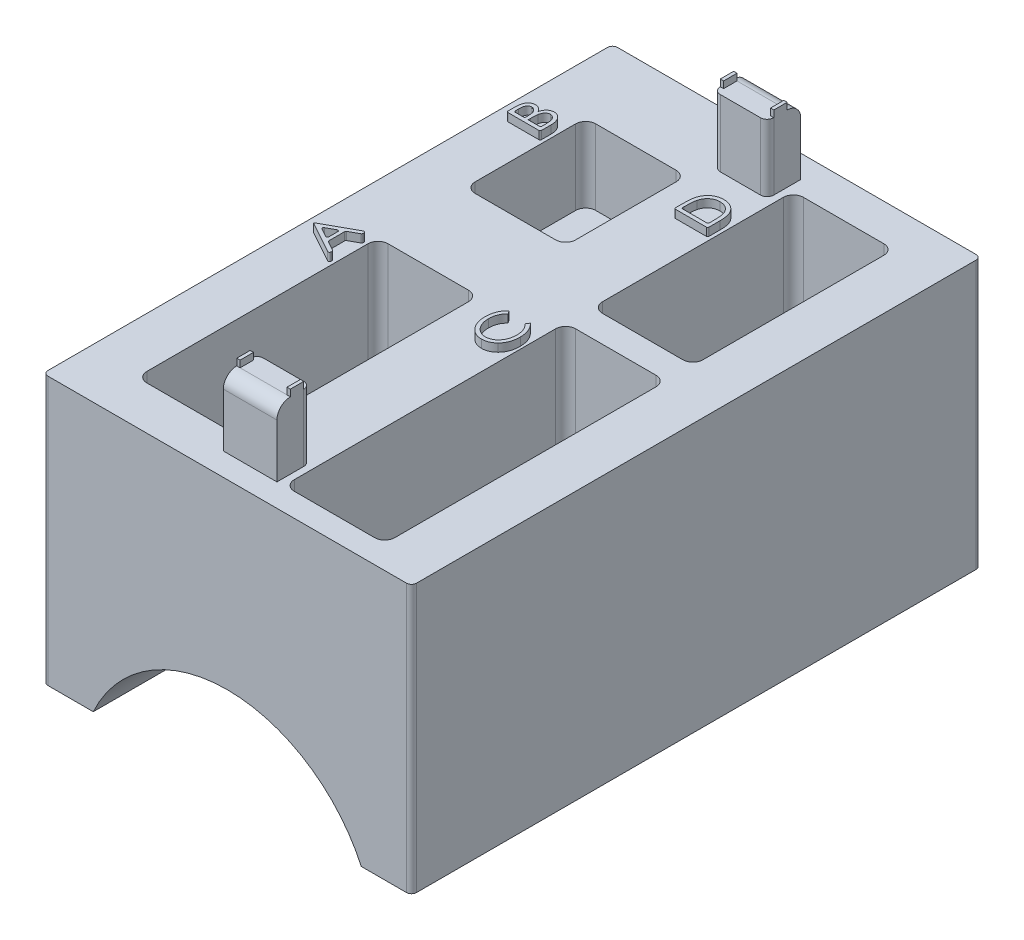
from build123d import *

# Parameters (mm, degrees)
BOSS_EXTRUDE1_DEPTH = 42.5
SKETCH2_W           = 15
SKETCH2_H           = 36
CUT_EXTRUDE1_DEPTH  = 20.4
SKETCH2_4_W         = 15
SKETCH2_4_H         = 18
CUT_EXTRUDE2_DEPTH  = 11.2
SKETCH2_5_W         = 15
SKETCH2_5_H         = 42
CUT_EXTRUDE3_DEPTH  = 24.222
SKETCH2_6_W         = 15
SKETCH2_6_H         = 30
CUT_EXTRUDE4_DEPTH  = 19.6
FILLET1_R           = 1.5
FILLET2_R           = 0.75
BOSS_EXTRUDE2_DEPTH = 1.2
FILLET4_R           = 0.2
BOSS_EXTRUDE3_DEPTH = 10
FILLET5_R           = 2
FILLET6_R           = 1
SKETCH7_W           = 0.5
SKETCH7_H           = 2
BOSS_EXTRUDE4_DEPTH = 1


with BuildPart() as part:
    # Sketch1 → Boss-Extrude1 (new, symmetric)
    with BuildSketch(Plane.XY):
        with BuildLine():
            Line((-20, 0), (-27.5, 0))
            Line((-27.5, 0), (-27.5, 40))
            Line((-27.5, 40), (27.5, 40))
            Line((27.5, 40), (27.5, 0))
            Line((27.5, 0), (20, 0))
            ThreePointArc((20, 0), (0, 12.850442522), (-20, 0))
        make_face()
    extrude(amount=BOSS_EXTRUDE1_DEPTH, both=True)

    # Sketch2 → Cut-Extrude1 (cut)
    with BuildSketch(Plane(origin=(0, 40, 0), x_dir=(1, 0, 0), z_dir=(0, 1, 0))):
        with Locations((-12.5, -18)):
            Rectangle(SKETCH2_W, SKETCH2_H)
    extrude(amount=-CUT_EXTRUDE1_DEPTH, mode=Mode.SUBTRACT)

    # Sketch2<4> → Cut-Extrude2 (cut)
    with BuildSketch(Plane(origin=(0, 40, 0), x_dir=(1, 0, 0), z_dir=(0, 1, 0))):
        with Locations((-12.5, 22)):
            Rectangle(SKETCH2_4_W, SKETCH2_4_H)
    extrude(amount=-CUT_EXTRUDE2_DEPTH, mode=Mode.SUBTRACT)

    # Sketch2<5> → Cut-Extrude3 (cut)
    with BuildSketch(Plane(origin=(0, 40, 0), x_dir=(1, 0, 0), z_dir=(0, 1, 0))):
        with Locations((12.5, -18)):
            Rectangle(SKETCH2_5_W, SKETCH2_5_H)
    extrude(amount=-CUT_EXTRUDE3_DEPTH, mode=Mode.SUBTRACT)

    # Sketch2<6> → Cut-Extrude4 (cut)
    with BuildSketch(Plane(origin=(0, 40, 0), x_dir=(1, 0, 0), z_dir=(0, 1, 0))):
        with Locations((12.5, 22)):
            Rectangle(SKETCH2_6_W, SKETCH2_6_H)
    extrude(amount=-CUT_EXTRUDE4_DEPTH, mode=Mode.SUBTRACT)

    # Fillet1
    fillet1_edges = [part.edges().sort_by_distance(p)[0] for p in [
        (20, 27.889, 39),
        (20, 27.889, -3),
        (5, 27.889, 39),
        (5, 27.889, -3),
        (20, 30.2, -7),
        (20, 30.2, -37),
        (5, 30.2, -7),
        (5, 30.2, -37),
        (-5, 34.4, -31),
        (-20, 34.4, -31),
        (-5, 34.4, -13),
        (-20, 34.4, -13),
        (-5, 29.8, 36),
        (-20, 29.8, 36),
        (-5, 29.8, 0),
        (-20, 29.8, 0),
    ]]
    fillet(fillet1_edges, radius=FILLET1_R)

    # Fillet2
    fillet2_edges = [part.edges().sort_by_distance(p)[0] for p in [
        (-27.5, 20, -42.5),
        (27.5, 20, -42.5),
        (-27.5, 20, 42.5),
        (27.5, 20, 42.5),
    ]]
    fillet(fillet2_edges, radius=FILLET2_R)

    # Sketch5 → Boss-Extrude2 (add)
    # profile 1 of 4: a face of its own
    with BuildSketch(Plane(origin=(0, 40, 0), x_dir=(1, 0, 0), z_dir=(0, 1, 0))):
        Polygon((-25.5, -4.115384615), (-20.5, -6.871794872), (-20.5, -6.235777244), (-22.102564103, -5.352363782), (-22.102564103, -2.751201923), (-20.5, -1.866786859), (-20.5, -1.230769231), (-25.5, -3.987179487), align=None)
        Polygon((-24.461338141, -4.051282051), (-22.615384615, -3.032652244), (-22.615384615, -5.068910256), align=None, mode=Mode.SUBTRACT)
    # profile 2 of 4: a face of its own
    with BuildSketch(Plane(origin=(0, 40, 0), x_dir=(1, 0, 0), z_dir=(0, 1, 0))):
        with BuildLine():
            Line((-25.5, 24.705128205), (-25.5, 25.876001603))
            add(Edge.make_bspline(
                [(-25.5, 25.876001603), (-25.499742433, 25.933103166), (-25.499240644, 26.044347721), (-25.491718192, 26.205976254), (-25.481597085, 26.357417989), (-25.464581303, 26.498199584), (-25.447103367, 26.629267155), (-25.421387349, 26.74974346), (-25.392719866, 26.86018845), (-25.349420335, 26.992410975), (-25.282058739, 27.142330247), (-25.18083749, 27.303727704), (-25.061157274, 27.445633304), (-24.922292074, 27.564683477), (-24.770646634, 27.661094775), (-24.608314865, 27.731508422), (-24.437110864, 27.773870443), (-24.320010934, 27.779310605), (-24.261017628, 27.782051282)],
                knots=[0, 0, 0, 0, 1.070853485, 2.086223449, 3.034271819, 3.916640579, 4.745529013, 5.513087507, 6.225428865, 6.884831129, 8.120833458, 9.29701588, 10.447582825, 11.588636263, 12.71438098, 13.805475256, 14.89442916, 16, 16, 16, 16], degree=3))
            add(Edge.make_bspline(
                [(-24.261017628, 27.782051282), (-24.205720411, 27.780200051), (-24.096634851, 27.776548102), (-23.93783809, 27.739448418), (-23.786226163, 27.682303211), (-23.643756772, 27.600210112), (-23.510966162, 27.496658706), (-23.390736803, 27.37101206), (-23.284556302, 27.222909914), (-23.227024425, 27.112766211), (-23.197315705, 27.055889423)],
                knots=[0, 0, 0, 0, 0.972469563, 1.918403701, 2.856555263, 3.817919515, 4.802528741, 5.813205558, 6.870767551, 8, 8, 8, 8], degree=3))
            add(Edge.make_bspline(
                [(-23.197315705, 27.055889423), (-23.175528868, 27.124976233), (-23.134010452, 27.256632564), (-23.060781467, 27.439035026), (-22.98019595, 27.595676288), (-22.8948897, 27.730013051), (-22.79880937, 27.842918214), (-22.696995011, 27.943375401), (-22.583819936, 28.028305778), (-22.463239999, 28.100984375), (-22.335447731, 28.159439189), (-22.201008989, 28.200230211), (-22.061863716, 28.226590056), (-21.967133457, 28.229366452), (-21.919270833, 28.230769231)],
                knots=[0, 0, 0, 0, 1.388621881, 2.646248426, 3.762785984, 4.762390772, 5.689342799, 6.59922982, 7.499246159, 8.395041384, 9.294579566, 10.185467042, 11.083204162, 12, 12, 12, 12], degree=3))
            add(Edge.make_bspline(
                [(-21.919270833, 28.230769231), (-21.870433022, 28.229252528), (-21.77415246, 28.226262447), (-21.632681278, 28.201818451), (-21.497854554, 28.160094593), (-21.367995741, 28.103803482), (-21.244605642, 28.029898943), (-21.126375989, 27.940192743), (-21.015612042, 27.83276415), (-20.90950492, 27.712201791), (-20.812528546, 27.57793568), (-20.729489519, 27.430297992), (-20.658235192, 27.272839854), (-20.59967908, 27.103949269), (-20.555152426, 26.923829022), (-20.523698385, 26.732570811), (-20.502662562, 26.530850823), (-20.500901825, 26.392550369), (-20.5, 26.321714744)],
                knots=[0, 0, 0, 0, 0.883480968, 1.741725178, 2.588427826, 3.432604319, 4.296825558, 5.185045933, 6.112416565, 7.084380859, 8.088800564, 9.103544349, 10.144658733, 11.212825849, 12.333889631, 13.498071228, 14.718545845, 16, 16, 16, 16], degree=3))
            Line((-20.5, 26.321714744), (-20.5, 24.705128205))
            Line((-20.5, 24.705128205), (-25.5, 24.705128205))
        make_face()
        with BuildLine():
            Line((-24.987179487, 25.282051282), (-23.384615385, 25.282051282))
            Line((-23.384615385, 25.282051282), (-23.384615385, 25.629607372))
            add(Edge.make_bspline(
                [(-23.384615385, 25.629607372), (-23.385186715, 25.680688345), (-23.386288464, 25.779192558), (-23.389434138, 25.921522709), (-23.398308434, 26.053354549), (-23.407188311, 26.174760161), (-23.421559434, 26.285982245), (-23.438623606, 26.386460575), (-23.456634881, 26.477154875), (-23.487672071, 26.58142093), (-23.532574694, 26.699651725), (-23.603234029, 26.826387145), (-23.686682633, 26.938830634), (-23.785174751, 27.03221728), (-23.891974345, 27.109058349), (-24.006086172, 27.165283487), (-24.127261583, 27.198788303), (-24.210063814, 27.202996666), (-24.252003205, 27.205128205)],
                knots=[0, 0, 0, 0, 1.217991297, 2.34876639, 3.393475226, 4.367857859, 5.250526261, 6.065799894, 6.797994458, 7.452947233, 8.657678775, 9.805030627, 10.901929777, 11.982856145, 13.027564981, 14.027937423, 15.001148845, 16, 16, 16, 16], degree=3))
            add(Edge.make_bspline(
                [(-24.252003205, 27.205128205), (-24.279758381, 27.204022507), (-24.334237978, 27.201852172), (-24.414146952, 27.188992552), (-24.489285453, 27.166027237), (-24.559518078, 27.133322158), (-24.625075149, 27.091840064), (-24.686468602, 27.041557389), (-24.74281702, 26.981865079), (-24.794152157, 26.912974718), (-24.840860792, 26.83452486), (-24.879100734, 26.744158455), (-24.913542019, 26.644298349), (-24.939794297, 26.532747129), (-24.962151198, 26.411162655), (-24.976400895, 26.278587314), (-24.985677503, 26.135551306), (-24.986665769, 26.036608476), (-24.987179487, 25.985176282)],
                knots=[0, 0, 0, 0, 0.831748624, 1.632608283, 2.417312795, 3.178127827, 3.946858349, 4.735822925, 5.549511037, 6.399760427, 7.305564626, 8.277549265, 9.334078834, 10.46706291, 11.707104009, 13.035989179, 14.459255898, 16, 16, 16, 16], degree=3))
            Line((-24.987179487, 25.985176282), (-24.987179487, 25.282051282))
        make_face(mode=Mode.SUBTRACT)
        with BuildLine():
            Line((-22.871794872, 25.282051282), (-21.012820513, 25.282051282))
            Line((-21.012820513, 25.282051282), (-21.012820513, 26.021233974))
            add(Edge.make_bspline(
                [(-21.012820513, 26.021233974), (-21.01342097, 26.073982469), (-21.014580243, 26.175821329), (-21.017345887, 26.323201252), (-21.027497628, 26.459341581), (-21.037269196, 26.584791372), (-21.05316855, 26.698845817), (-21.068887809, 26.802879568), (-21.091357326, 26.895238187), (-21.122695229, 27.003203036), (-21.172097982, 27.123845054), (-21.245625533, 27.25540042), (-21.335091008, 27.371209827), (-21.438362777, 27.469851853), (-21.549493064, 27.551593612), (-21.668109614, 27.611031657), (-21.792393984, 27.646422428), (-21.876987346, 27.651372093), (-21.919270833, 27.653846154)],
                knots=[0, 0, 0, 0, 1.2146963, 2.345152887, 3.392917247, 4.357547669, 5.241457539, 6.043965284, 6.778618797, 7.428050789, 8.631456437, 9.770894858, 10.888761366, 11.987001558, 13.049551499, 14.053418612, 15.02701289, 16, 16, 16, 16], degree=3))
            add(Edge.make_bspline(
                [(-21.919270833, 27.653846154), (-21.945687977, 27.653075679), (-21.998130941, 27.651546142), (-22.075442033, 27.639329271), (-22.150003687, 27.618730345), (-22.222799078, 27.592315959), (-22.291669223, 27.555413778), (-22.358935739, 27.512219821), (-22.422445311, 27.459491541), (-22.484703776, 27.400876581), (-22.542572023, 27.334712228), (-22.595791768, 27.262315287), (-22.64400892, 27.183906095), (-22.686856677, 27.099225807), (-22.72617206, 27.00910234), (-22.759877278, 26.912928191), (-22.789251659, 26.810906427), (-22.804745977, 26.740481223), (-22.812700321, 26.704326923)],
                knots=[0, 0, 0, 0, 0.894864073, 1.776472303, 2.643663556, 3.513580789, 4.394026905, 5.28516475, 6.218050483, 7.186278866, 8.180270308, 9.191684169, 10.227787825, 11.29534454, 12.404989647, 13.557129632, 14.745899713, 16, 16, 16, 16], degree=3))
            add(Edge.make_bspline(
                [(-22.812700321, 26.704326923), (-22.817628775, 26.675986016), (-22.828262574, 26.614836719), (-22.839667051, 26.515515424), (-22.849701492, 26.402297408), (-22.857146059, 26.274679129), (-22.864816684, 26.132821778), (-22.867839231, 25.976500946), (-22.871408152, 25.805905184), (-22.87166239, 25.687369109), (-22.871794872, 25.625600962)],
                knots=[0, 0, 0, 0, 0.638221488, 1.377048218, 2.217499621, 3.160265518, 4.21357403, 5.369706301, 6.629376168, 8, 8, 8, 8], degree=3))
            Line((-22.871794872, 25.625600962), (-22.871794872, 25.282051282))
        make_face(mode=Mode.SUBTRACT)
    # profile 3 of 4: a face of its own
    with BuildSketch(Plane(origin=(0, 40, 0), x_dir=(1, 0, 0), z_dir=(0, 1, 0))):
        with BuildLine():
            Line((0.417467949, -0.846153846), (0.717948718, -1.310897436))
            add(Edge.make_bspline(
                [(0.717948718, -1.310897436), (0.684507466, -1.343234891), (0.617751867, -1.407787084), (0.52466175, -1.511369362), (0.437798306, -1.619640457), (0.3556211, -1.73183012), (0.282499674, -1.850657997), (0.212471435, -1.972506702), (0.150753619, -2.100337766), (0.094456067, -2.232201418), (0.045769706, -2.368563677), (0.002766971, -2.507934277), (-0.035075912, -2.650346846), (-0.063311885, -2.796755918), (-0.086486351, -2.946090668), (-0.103662633, -3.098765451), (-0.113885685, -3.254865075), (-0.114882119, -3.360161087), (-0.115384615, -3.413261218)],
                knots=[0, 0, 0, 0, 0.959111292, 1.914582868, 2.869434064, 3.82110258, 4.780090299, 5.745114483, 6.718161514, 7.70540377, 8.700704109, 9.702484692, 10.712817488, 11.737684842, 12.775719607, 13.828784515, 14.905069395, 16, 16, 16, 16], degree=3))
            add(Edge.make_bspline(
                [(-0.115384615, -3.413261218), (-0.11480957, -3.471387282), (-0.113667653, -3.586813227), (-0.09858906, -3.757911281), (-0.077036205, -3.925820083), (-0.045948065, -4.090378909), (-0.005460696, -4.251674091), (0.042029969, -4.410607435), (0.100679855, -4.565376873), (0.166189038, -4.716489261), (0.240253776, -4.861063819), (0.320360253, -4.998591639), (0.406334146, -5.127937292), (0.498519682, -5.248562661), (0.597530456, -5.360071555), (0.701213889, -5.464514451), (0.811726196, -5.559915672), (0.928065276, -5.646037114), (1.049142877, -5.723154811), (1.174398299, -5.790816066), (1.304501146, -5.846545731), (1.437373955, -5.894082184), (1.574080643, -5.930325058), (1.714545689, -5.954779778), (1.858354977, -5.97186482), (1.955878849, -5.973523426), (2.005008013, -5.974358974)],
                knots=[0, 0, 0, 0, 1.130265153, 2.244465111, 3.338343375, 4.422229198, 5.499558493, 6.57192442, 7.646666991, 8.71684805, 9.774024536, 10.80429048, 11.811121287, 12.793078285, 13.754659931, 14.709794802, 15.653670322, 16.591427122, 17.52282128, 18.443833912, 19.3570984, 20.273152404, 21.186763162, 22.1039214, 23.044820976, 24, 24, 24, 24], degree=3))
            add(Edge.make_bspline(
                [(2.005008013, -5.974358974), (2.078915627, -5.97194861), (2.224191715, -5.967210691), (2.437534896, -5.932746738), (2.640836077, -5.873862032), (2.83587065, -5.794044986), (3.019841292, -5.688167152), (3.195724989, -5.561303324), (3.360774358, -5.409970796), (3.515414924, -5.238252969), (3.655462064, -5.048826502), (3.779650637, -4.846241724), (3.882646537, -4.630302959), (3.968225671, -4.403252874), (4.034526906, -4.163542344), (4.080526722, -3.911784627), (4.111063791, -3.648385331), (4.113925629, -3.468771808), (4.115384615, -3.377203526)],
                knots=[0, 0, 0, 0, 0.950372396, 1.868094186, 2.770529589, 3.66764725, 4.571481153, 5.493962345, 6.451486312, 7.445703142, 8.461677117, 9.477215433, 10.497029643, 11.533842227, 12.594382524, 13.690909593, 14.822808885, 16, 16, 16, 16], degree=3))
            add(Edge.make_bspline(
                [(4.115384615, -3.377203526), (4.114923478, -3.326101927), (4.114012336, -3.225132352), (4.10325385, -3.075462359), (4.087822671, -2.928973396), (4.064306678, -2.785705915), (4.03574416, -2.645134753), (3.999180257, -2.507958382), (3.957768087, -2.37355989), (3.907744033, -2.242971112), (3.853492069, -2.114727551), (3.790660146, -1.990498221), (3.722808895, -1.868763472), (3.647231294, -1.750868884), (3.566603194, -1.63517677), (3.477360638, -1.524259874), (3.384150432, -1.41440644), (3.316221729, -1.345539731), (3.282051282, -1.310897436)],
                knots=[0, 0, 0, 0, 1.070808156, 2.115766403, 3.143503364, 4.156991828, 5.157424436, 6.148613157, 7.131243622, 8.103378835, 9.078230077, 10.048323279, 11.019551461, 11.99791226, 12.982185712, 13.973374433, 14.980538453, 16, 16, 16, 16], degree=3))
            Line((3.282051282, -1.310897436), (3.579527244, -0.846153846))
            add(Edge.make_bspline(
                [(3.579527244, -0.846153846), (3.620349949, -0.883099295), (3.702145998, -0.957126523), (3.817194413, -1.076284783), (3.924598086, -1.202984845), (4.024603353, -1.336314713), (4.118180626, -1.475901196), (4.204354314, -1.622436987), (4.283517922, -1.775948552), (4.355420326, -1.935761047), (4.419459783, -2.101296914), (4.475955557, -2.271618481), (4.52232743, -2.447079365), (4.562528025, -2.626928855), (4.590169185, -2.812189743), (4.612918661, -3.001479229), (4.626164016, -3.195722735), (4.627518313, -3.326770094), (4.628205128, -3.393229167)],
                knots=[0, 0, 0, 0, 0.929948751, 1.863329091, 2.795669339, 3.734198957, 4.677478856, 5.633188723, 6.6043843, 7.593977887, 8.592165455, 9.601682113, 10.623694698, 11.65697527, 12.713154107, 13.786349063, 14.877373888, 16, 16, 16, 16], degree=3))
            add(Edge.make_bspline(
                [(4.628205128, -3.393229167), (4.627845841, -3.456351557), (4.627138088, -3.580695056), (4.615000467, -3.764712653), (4.598877185, -3.943581597), (4.574063463, -4.117514126), (4.545146202, -4.286627863), (4.506195814, -4.450073368), (4.462641282, -4.608733346), (4.411171064, -4.762403996), (4.353537092, -4.911381083), (4.288168777, -5.055102032), (4.215820012, -5.193253744), (4.137783381, -5.326957827), (4.052471654, -5.455352819), (3.96010508, -5.578661388), (3.861110083, -5.697353227), (3.789643962, -5.771774679), (3.75380609, -5.809094551)],
                knots=[0, 0, 0, 0, 1.148145954, 2.261709096, 3.353861998, 4.414741617, 5.45730948, 6.473933583, 7.470156968, 8.449761459, 9.420949867, 10.375064094, 11.320515853, 12.257047779, 13.190343743, 14.123323402, 15.058909376, 16, 16, 16, 16], degree=3))
            add(Edge.make_bspline(
                [(3.75380609, -5.809094551), (3.691905788, -5.868575908), (3.569960056, -5.985756236), (3.368441256, -6.135518144), (3.160081573, -6.265139038), (2.940718396, -6.370115235), (2.711643875, -6.451209806), (2.473149273, -6.509591674), (2.225036036, -6.544113567), (2.056531771, -6.548867614), (1.970953526, -6.551282051)],
                knots=[0, 0, 0, 0, 1.037169529, 2.043259798, 3.029279505, 4.000785947, 4.977646465, 5.962715201, 6.965324361, 8, 8, 8, 8], degree=3))
            add(Edge.make_bspline(
                [(1.970953526, -6.551282051), (1.925536238, -6.550329428), (1.835597399, -6.548442969), (1.702047518, -6.538939747), (1.571536234, -6.520004063), (1.443122524, -6.496979639), (1.318100069, -6.46400274), (1.195192395, -6.426773656), (1.076108519, -6.379602339), (0.95834823, -6.328367615), (0.844614294, -6.267551352), (0.732485217, -6.20146246), (0.623597736, -6.127298037), (0.517683899, -6.045907383), (0.413620188, -5.958828162), (0.314187641, -5.862977861), (0.215158205, -5.762101713), (0.089463641, -5.616572344), (-0.058153806, -5.42467279), (-0.210761762, -5.177142838), (-0.339060859, -4.915103992), (-0.445928549, -4.639927954), (-0.528081193, -4.350151077), (-0.585464604, -4.046438156), (-0.621479921, -3.728630383), (-0.625933014, -3.511850278), (-0.628205128, -3.401241987)],
                knots=[0, 0, 0, 0, 0.718650565, 1.423127645, 2.116326935, 2.804193222, 3.485723535, 4.160651769, 4.834525121, 5.510795429, 6.191240094, 6.87334326, 7.56921377, 8.27384924, 8.985987223, 9.714527276, 10.457851907, 11.22155856, 12.755469605, 14.282846379, 15.813543898, 17.365311537, 18.946959557, 20.571248182, 22.250538814, 24, 24, 24, 24], degree=3))
            add(Edge.make_bspline(
                [(-0.628205128, -3.401241987), (-0.627532044, -3.333779251), (-0.626204562, -3.200726654), (-0.61275499, -3.003516653), (-0.590828835, -2.811700393), (-0.560588388, -2.624566006), (-0.522881783, -2.442237319), (-0.476022065, -2.264918466), (-0.419261014, -2.093039686), (-0.355630235, -1.926010912), (-0.283726835, -1.765169735), (-0.204356497, -1.611412768), (-0.118106225, -1.464939851), (-0.025189489, -1.325525058), (0.075226345, -1.194378916), (0.181803398, -1.070223639), (0.295888337, -0.954094441), (0.376985241, -0.882095132), (0.417467949, -0.846153846)],
                knots=[0, 0, 0, 0, 1.136191434, 2.240840331, 3.327637968, 4.387147135, 5.432714784, 6.462587591, 7.474477613, 8.480223321, 9.472037046, 10.440375903, 11.393274601, 12.333779893, 13.26058387, 14.173706063, 15.08833359, 16, 16, 16, 16], degree=3))
        make_face()
    # profile 4 of 4: a face of its own
    with BuildSketch(Plane(origin=(0, 40, 0), x_dir=(1, 0, 0), z_dir=(0, 1, 0))):
        with BuildLine():
            Line((4.5, 24.705128205), (-0.5, 24.705128205))
            Line((-0.5, 24.705128205), (-0.5, 25.904046474))
            add(Edge.make_bspline(
                [(-0.5, 25.904046474), (-0.499369874, 26.008551898), (-0.498153719, 26.210249561), (-0.490402016, 26.501466887), (-0.476757377, 26.770352661), (-0.456635258, 27.016810065), (-0.432350205, 27.241440294), (-0.401465226, 27.44397456), (-0.365608747, 27.624451133), (-0.33437187, 27.735801218), (-0.319711538, 27.788060897)],
                knots=[0, 0, 0, 0, 1.3211948, 2.549933714, 3.682670825, 4.72443222, 5.675778669, 6.538377397, 7.314020028, 8, 8, 8, 8], degree=3))
            add(Edge.make_bspline(
                [(-0.319711538, 27.788060897), (-0.297682718, 27.856531803), (-0.254243412, 27.991551685), (-0.172594056, 28.185026692), (-0.079300313, 28.367248296), (0.026220833, 28.537826836), (0.142438175, 28.697454068), (0.269972193, 28.846008019), (0.411108144, 28.98095405), (0.562029853, 29.105463046), (0.722959355, 29.216219553), (0.891931921, 29.313221814), (1.068956169, 29.393955755), (1.252720889, 29.462088799), (1.44513671, 29.512605851), (1.644671357, 29.549317706), (1.851501449, 29.573581884), (1.99191814, 29.575799088), (2.063100962, 29.576923077)],
                knots=[0, 0, 0, 0, 1.074383784, 2.118610368, 3.133831698, 4.130683461, 5.112592167, 6.081756803, 7.052037937, 8.026823342, 9.002438226, 9.967768749, 10.934348959, 11.906590479, 12.892862037, 13.90267537, 14.936782487, 16, 16, 16, 16], degree=3))
            add(Edge.make_bspline(
                [(2.063100962, 29.576923077), (2.12489884, 29.575680232), (2.246727832, 29.573230075), (2.426618521, 29.556469863), (2.60048541, 29.525842952), (2.768847684, 29.484922789), (2.932298628, 29.433089207), (3.089263701, 29.367425055), (3.241338507, 29.29151694), (3.38591675, 29.202937322), (3.523600344, 29.106484901), (3.652650695, 29.001906205), (3.771517587, 28.889483935), (3.882315923, 28.771053372), (3.983774681, 28.645784467), (4.075321013, 28.51273247), (4.157271746, 28.372764917), (4.230203959, 28.224485631), (4.295266802, 28.065887552), (4.349588356, 27.892777287), (4.396843327, 27.705240613), (4.434237771, 27.502073662), (4.464311751, 27.284192931), (4.484636508, 27.050855608), (4.498149851, 26.802978561), (4.499372353, 26.632564642), (4.5, 26.545072115)],
                knots=[0, 0, 0, 0, 1.007696365, 1.986583288, 2.942476535, 3.883935895, 4.810208792, 5.735297012, 6.655615172, 7.579019823, 8.497339111, 9.395210487, 10.284874381, 11.163121431, 12.038021091, 12.910868805, 13.794163487, 14.680406065, 15.603425469, 16.586527096, 17.636245197, 18.755252064, 19.953260855, 21.221466197, 22.573467817, 24, 24, 24, 24], degree=3))
            Line((4.5, 26.545072115), (4.5, 24.705128205))
        make_face()
        with BuildLine():
            Line((3.987179487, 25.282051282), (3.987179487, 25.948116987))
            add(Edge.make_bspline(
                [(3.987179487, 25.948116987), (3.986827562, 26.043940309), (3.986151838, 26.227928351), (3.980158627, 26.492395404), (3.970388961, 26.733838972), (3.95669786, 26.952614843), (3.938693891, 27.148313832), (3.918352967, 27.321527738), (3.893338066, 27.471857393), (3.870511561, 27.563480488), (3.859975962, 27.605769231)],
                knots=[0, 0, 0, 0, 1.380201592, 2.650091708, 3.810045458, 4.860555721, 5.807075929, 6.640357142, 7.372455316, 8, 8, 8, 8], degree=3))
            add(Edge.make_bspline(
                [(3.859975962, 27.605769231), (3.843964511, 27.658744543), (3.81250508, 27.762830874), (3.754226809, 27.913111777), (3.685854848, 28.054023059), (3.609978624, 28.18732365), (3.52347734, 28.310776694), (3.427676704, 28.425049603), (3.32453895, 28.532300484), (3.211276292, 28.628741165), (3.091035613, 28.716340674), (2.963511717, 28.792823752), (2.828943191, 28.856987492), (2.687973263, 28.908938024), (2.541074067, 28.950500264), (2.387214557, 28.979265669), (2.226753234, 28.996411013), (2.11756362, 28.998791037), (2.062099359, 29)],
                knots=[0, 0, 0, 0, 1.078695871, 2.119430535, 3.138360829, 4.129788677, 5.106687353, 6.072595079, 7.034635114, 8.003979972, 8.968746585, 9.932106895, 10.898694259, 11.870788789, 12.85786961, 13.871484526, 14.918793341, 16, 16, 16, 16], degree=3))
            add(Edge.make_bspline(
                [(2.062099359, 29), (2.003620138, 28.998956923), (1.888676153, 28.9969067), (1.71980816, 28.977443192), (1.557753759, 28.945290728), (1.402040294, 28.901001766), (1.251916992, 28.845521489), (1.109426812, 28.774353641), (0.972855015, 28.69231735), (0.843255425, 28.598033913), (0.722800419, 28.491916943), (0.610342858, 28.376396094), (0.509811769, 28.249350559), (0.41664285, 28.114265332), (0.335963782, 27.967737767), (0.263293342, 27.812531031), (0.202262573, 27.646396097), (0.169652346, 27.53121473), (0.153044872, 27.47255609)],
                knots=[0, 0, 0, 0, 1.058669847, 2.080871278, 3.073316351, 4.047471421, 5.009847859, 5.967025571, 6.92717743, 7.89220902, 8.864786813, 9.831124328, 10.807453351, 11.795172645, 12.799353072, 13.832651409, 14.896230148, 16, 16, 16, 16], degree=3))
            add(Edge.make_bspline(
                [(0.153044872, 27.47255609), (0.141425862, 27.423933808), (0.116586119, 27.319986484), (0.090112521, 27.151475409), (0.065976181, 26.961440111), (0.046186266, 26.74965739), (0.03163291, 26.51549051), (0.020906167, 26.25969425), (0.013570006, 25.981880006), (0.013076601, 25.789535021), (0.012820513, 25.689703526)],
                knots=[0, 0, 0, 0, 0.669246088, 1.430750214, 2.28257198, 3.234651627, 4.278572046, 5.424227125, 6.663114321, 8, 8, 8, 8], degree=3))
            Line((0.012820513, 25.689703526), (0.012820513, 25.282051282))
            Line((0.012820513, 25.282051282), (3.987179487, 25.282051282))
        make_face(mode=Mode.SUBTRACT)
    extrude(amount=BOSS_EXTRUDE2_DEPTH)

    # Fillet4
    fillet4_edges = [part.edges().sort_by_distance(p)[0] for p in [
        (-20.5, 40.6, 1.866786859),
        (-20.5, 40.6, 6.235777244),
        (0.012820513, 40.6, -25.282051282),
        (3.987179487, 40.6, -25.282051282),
        (4.5, 40.6, -24.705128205),
        (-0.5, 40.6, -24.705128205),
        (-25.5, 40.6, -24.705128205),
        (-24.987179487, 40.6, -25.282051282),
        (-23.384615385, 40.6, -25.282051282),
        (-21.012820513, 40.6, -25.282051282),
        (-20.5, 40.6, -24.705128205),
        (-20.5, 40.6, 1.230769231),
        (-20.5, 40.6, 6.871794872),
        (-22.102564103, 40.6, 2.751201923),
        (-22.102564103, 40.6, 5.352363782),
        (-22.615384615, 40.6, 3.032652244),
        (-22.615384615, 40.6, 5.068910256),
        (-24.461338141, 40.6, 4.051282051),
    ]]
    fillet(fillet4_edges, radius=FILLET4_R)

    # Sketch6 → Boss-Extrude3 (add)
    with BuildSketch(Plane(origin=(0, 40, 0), x_dir=(1, 0, 0), z_dir=(0, 1, 0))):
        Polygon((2, -39.085714072), (-3, -39.085714072), (-4, -39.085714072), (-4, -38.085714072), (-4, -35.085714072), (-4, -34.085714072), (-3, -34.085714072), (2, -34.085714072), (4, -34.085714072), (4, -35.085714072), (4, -38.085714072), (4, -39.085714072), align=None)
        Polygon((2.5, 34.085714072), (-2.5, 34.085714072), (-4, 34.085714072), (-4, 35.085714072), (-4, 38.085714072), (-4, 39.085714072), (-2.5, 39.085714072), (2.5, 39.085714072), (4, 39.085714072), (4, 38.085714072), (4, 35.085714072), (4, 34.085714072), align=None)
    extrude(amount=BOSS_EXTRUDE3_DEPTH)

    # Fillet5
    fillet5_edges = [part.edges().sort_by_distance(p)[0] for p in [
        (0, 50, 39.085714072),
        (0, 50, -39.085714072),
    ]]
    fillet(fillet5_edges, radius=FILLET5_R)

    # Fillet6
    fillet6_edges = [part.edges().sort_by_distance(p)[0] for p in [
        (-4, 45, -34.085714072),
        (4, 45, -34.085714072),
        (-4, 45, 34.085714072),
        (4, 45, 34.085714072),
    ]]
    fillet(fillet6_edges, radius=FILLET6_R)

    # Sketch7 → Boss-Extrude4 (add)
    with BuildSketch(Plane(origin=(0, 50, 0), x_dir=(1, 0, 0), z_dir=(0, 1, 0))):
        with Locations((-3.75, -36.085714072)):
            Rectangle(SKETCH7_W, SKETCH7_H)
        with Locations((3.75, -36.085714072)):
            Rectangle(SKETCH7_W, SKETCH7_H)
    boss_extrude4 = extrude(amount=BOSS_EXTRUDE4_DEPTH)

    # Mirror1: Boss-Extrude4 across plane
    add(boss_extrude4.mirror(Plane.XY))


solid = part.part
